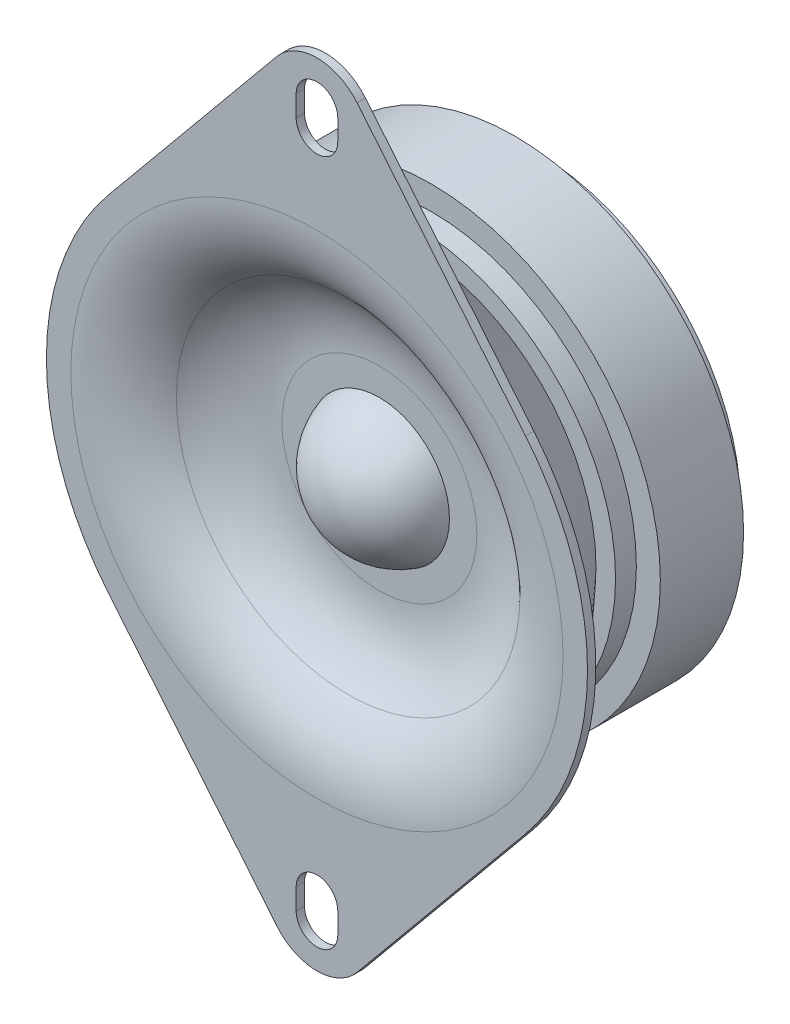
from build123d import *

# Parameters (mm, degrees)
SKETCH_1_R      = 26
SKETCH_2_R      = 16
SHELL_1_T       = -5
FILLET_1_R      = 10
SKETCH_4_R      = 22
EXTRUDE_1_DEPTH = 8
SKETCH_5_R      = 19.696379945
EXTRUDE_2_DEPTH = 12
FILLET_2_R      = 10
SKETCH_6_R      = 23.647308565
EXTRUDE_3_DEPTH = 0.8


with BuildPart() as part:
    # 草图1 → 放样1 section 0
    with BuildSketch(Plane.XY):
        Circle(SKETCH_1_R)
    # 草图2 → 放样1 section 1
    with BuildSketch(Plane.XY.offset(-11)):
        Circle(SKETCH_2_R)
    loft()

    # 抽壳1
    shell_1_openings = [part.faces().sort_by_distance(p)[0] for p in [
        (0, 0, 0),
    ]]
    offset(amount=SHELL_1_T, openings=shell_1_openings, kind=Kind.INTERSECTION)

    # 圆角1
    fillet_1_edges = [part.edges().sort_by_distance(p)[0] for p in [
        (-13.788150569, 0, -6),
    ]]
    fillet(fillet_1_edges, radius=FILLET_1_R)

    # 草图3 → 旋转1 (revolve)
    with BuildSketch(Plane(origin=(0, 0, 0), x_dir=(1, 0, 0), z_dir=(0, 1, 0)), mode=Mode.PRIVATE) as revolve_1_sk:
        with BuildLine():
            Line((0, 6), (6.731942195, 6))
            ThreePointArc((6.731942195, 6), (4.217222472, 2.331539651), (0, 0.91858132))
            Line((0, 0.91858132), (0, 6))
        make_face()
    revolve(revolve_1_sk.sketch.rotate(Axis((0, 0, 7.141645332), (0, 0, -1)), 180), axis=Axis((0, 0, 7.141645332), (0, 0, -1)))

    # 草图4 → 拉伸1 (add)
    with BuildSketch(Plane(origin=(0, 0, -11), x_dir=(-1, 0, 0), z_dir=(0, 0, -1))):
        Circle(SKETCH_4_R)
    extrude(amount=EXTRUDE_1_DEPTH)

    # 草图5 → 拉伸2 (add)
    with BuildSketch(Plane(origin=(0, 0, -21), x_dir=(-1, 0, 0), z_dir=(0, 0, -1))):
        Circle(SKETCH_5_R)
    extrude(amount=-EXTRUDE_2_DEPTH)

    # 圆角2
    fillet_2_edges = [part.edges().sort_by_distance(p)[0] for p in [
        (-19.242696024, 0, 0),
    ]]
    fillet(fillet_2_edges, radius=FILLET_2_R)

    # 草图6 → 拉伸3 (add)
    with BuildSketch(Plane.XY):
        with BuildLine():
            Line((-3.856946079, 36.181818182), (-20.056119612, 16.545454545))
            ThreePointArc((-20.056119612, 16.545454545), (-26, 0), (-20.056119612, -16.545454545))
            Line((-20.056119612, -16.545454545), (-3.856946079, -36.181818182))
            ThreePointArc((-3.856946079, -36.181818182), (0, -38), (3.856946079, -36.181818182))
            Line((3.856946079, -36.181818182), (20.056119612, -16.545454545))
            ThreePointArc((20.056119612, -16.545454545), (26, 0), (20.056119612, 16.545454545))
            Line((20.056119612, 16.545454545), (3.856946079, 36.181818182))
            ThreePointArc((3.856946079, 36.181818182), (0, 38), (-3.856946079, 36.181818182))
        make_face()
        Circle(SKETCH_6_R, mode=Mode.SUBTRACT)
        with BuildLine():
            Line((-2, 34), (-2, 32))
            ThreePointArc((-2, 32), (0, 30), (2, 32))
            Line((2, 32), (2, 34))
            ThreePointArc((2, 34), (0, 36), (-2, 34))
        make_face(mode=Mode.SUBTRACT)
        with BuildLine():
            Line((2, -34), (2, -32))
            ThreePointArc((2, -32), (0, -30), (-2, -32))
            Line((-2, -32), (-2, -34))
            ThreePointArc((-2, -34), (0, -36), (2, -34))
        make_face(mode=Mode.SUBTRACT)
    extrude(amount=-EXTRUDE_3_DEPTH)


solid = part.part
